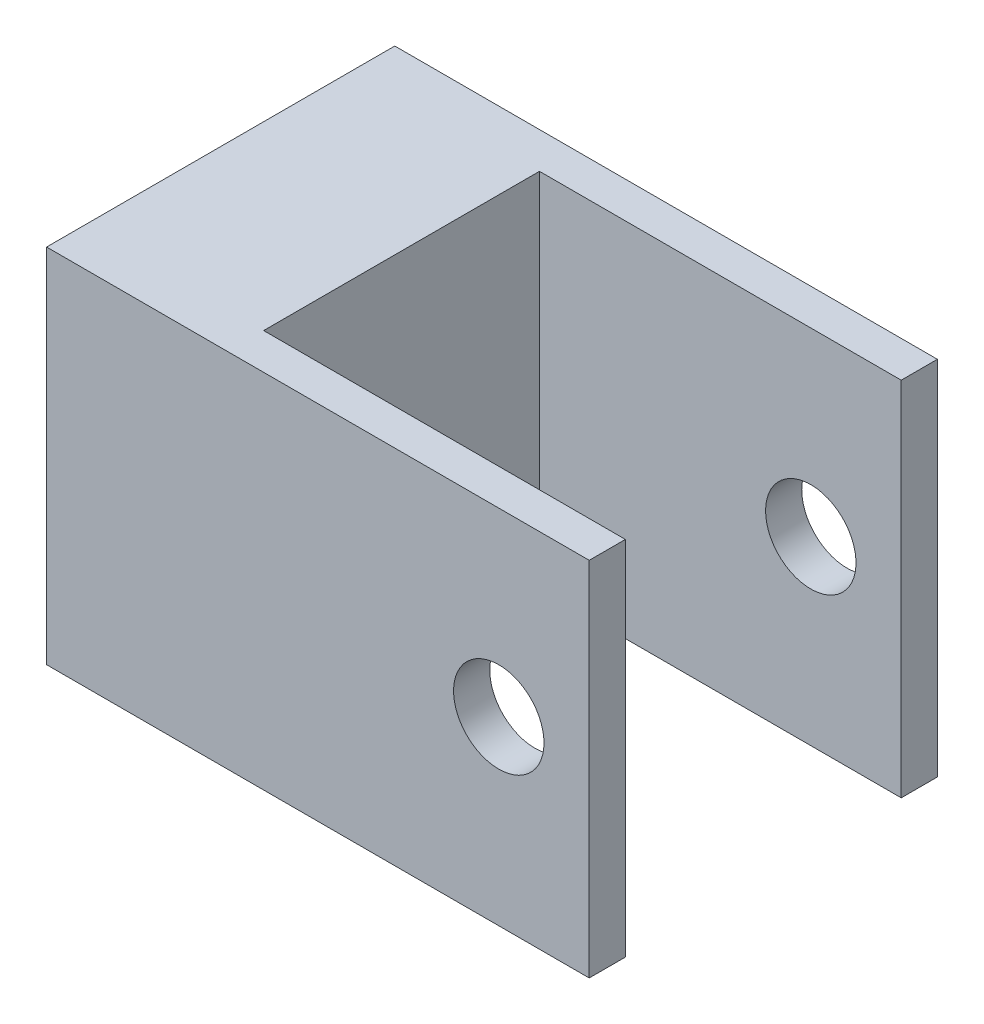
from build123d import *

# Parameters (mm, degrees)
BOSS_EXTRUDE1_DEPTH      = 40
BOSS_EXTRUDE1_DEPTH_BACK = 40
SKETCH1_W                = 120
SKETCH1_H                = 77
CUT_EXTRUDE1_DEPTH       = 100
CUT_EXTRUDE1_DEPTH_BACK  = 100
SKETCH2_W                = 80
SKETCH2_H                = 61
CUT_EXTRUDE2_DEPTH       = 100
CUT_EXTRUDE2_DEPTH_BACK  = 100
SKETCH3_R                = 10


with BuildPart() as part:
    # Sketch1 → Boss-Extrude1 (new, two sides: drawn at the far end of the back side and taken through both)
    with BuildSketch(Plane(origin=(0, 0, 0), x_dir=(1, 0, 0), z_dir=(0, 1, 0)).offset(-BOSS_EXTRUDE1_DEPTH_BACK)):
        with Locations((60, 0)):
            Rectangle(SKETCH1_W, SKETCH1_H)
    extrude(amount=BOSS_EXTRUDE1_DEPTH + BOSS_EXTRUDE1_DEPTH_BACK)

    # Sketch2 → Cut-Extrude1 (cut, two sides: drawn at the far end of the back side and taken through both)
    with BuildSketch(Plane(origin=(0, 0, 0), x_dir=(1, 0, 0), z_dir=(0, 1, 0)).offset(-CUT_EXTRUDE1_DEPTH_BACK)):
        with Locations((80, 0)):
            Rectangle(SKETCH2_W, SKETCH2_H)
    extrude(amount=CUT_EXTRUDE1_DEPTH + CUT_EXTRUDE1_DEPTH_BACK, mode=Mode.SUBTRACT)

    # Sketch3 → Cut-Extrude2 (cut, two sides: drawn at the far end of the back side and taken through both)
    with BuildSketch(Plane.XY.offset(-CUT_EXTRUDE2_DEPTH_BACK)):
        with Locations((100, 0)):
            Circle(SKETCH3_R)
    extrude(amount=CUT_EXTRUDE2_DEPTH + CUT_EXTRUDE2_DEPTH_BACK, mode=Mode.SUBTRACT)


solid = part.part
